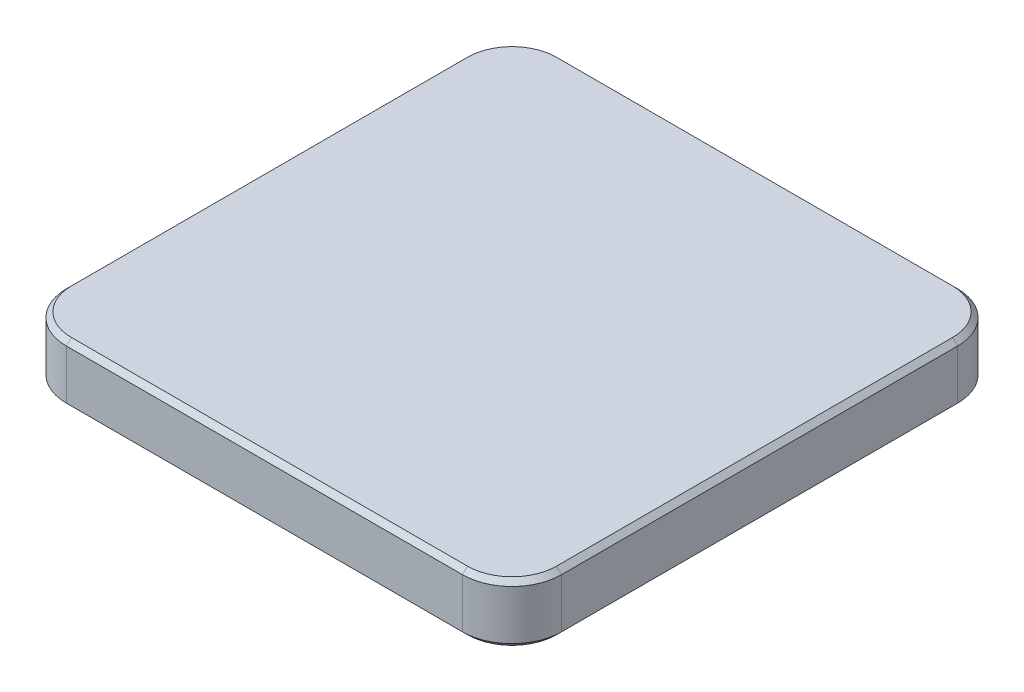
from build123d import *

# Parameters (mm, degrees)
SKETCH_1_W      = 100
SKETCH_1_H      = 100
EXTRUDE_1_DEPTH = 12
FILLET_1_R      = 10
CHAMFER_1_SIZE  = 1


with BuildPart() as part:
    # 草圖1 → 填料-伸長1 (new body)
    with BuildSketch(Plane(origin=(0, 0, 0), x_dir=(1, 0, 0), z_dir=(0, 1, 0))):
        with Locations((50, 50)):
            Rectangle(SKETCH_1_W, SKETCH_1_H)
    extrude(amount=EXTRUDE_1_DEPTH)

    # 圓角1
    fillet_1_edges = [part.edges().sort_by_distance(p)[0] for p in [
        (0, 6, -100),
        (100, 6, -100),
        (100, 6, 0),
        (0, 6, 0),
    ]]
    fillet(fillet_1_edges, radius=FILLET_1_R)

    # 導角1
    chamfer_1_edges = [part.edges().sort_by_distance(p)[0] for p in [
        (0, 0, -50),
        (0, 12, -50),
        (50, 0, -100),
        (100, 0, -50),
        (50, 0, 0),
        (2.928932188, 0, -2.928932188),
        (97.071067812, 0, -2.928932188),
        (97.071067812, 0, -97.071067812),
        (2.928932188, 0, -97.071067812),
        (50, 12, -100),
        (50, 12, 0),
        (100, 12, -50),
        (2.928932188, 12, -2.928932188),
        (97.071067812, 12, -2.928932188),
        (97.071067812, 12, -97.071067812),
        (2.928932188, 12, -97.071067812),
    ]]
    chamfer(chamfer_1_edges, length=CHAMFER_1_SIZE)


solid = part.part
